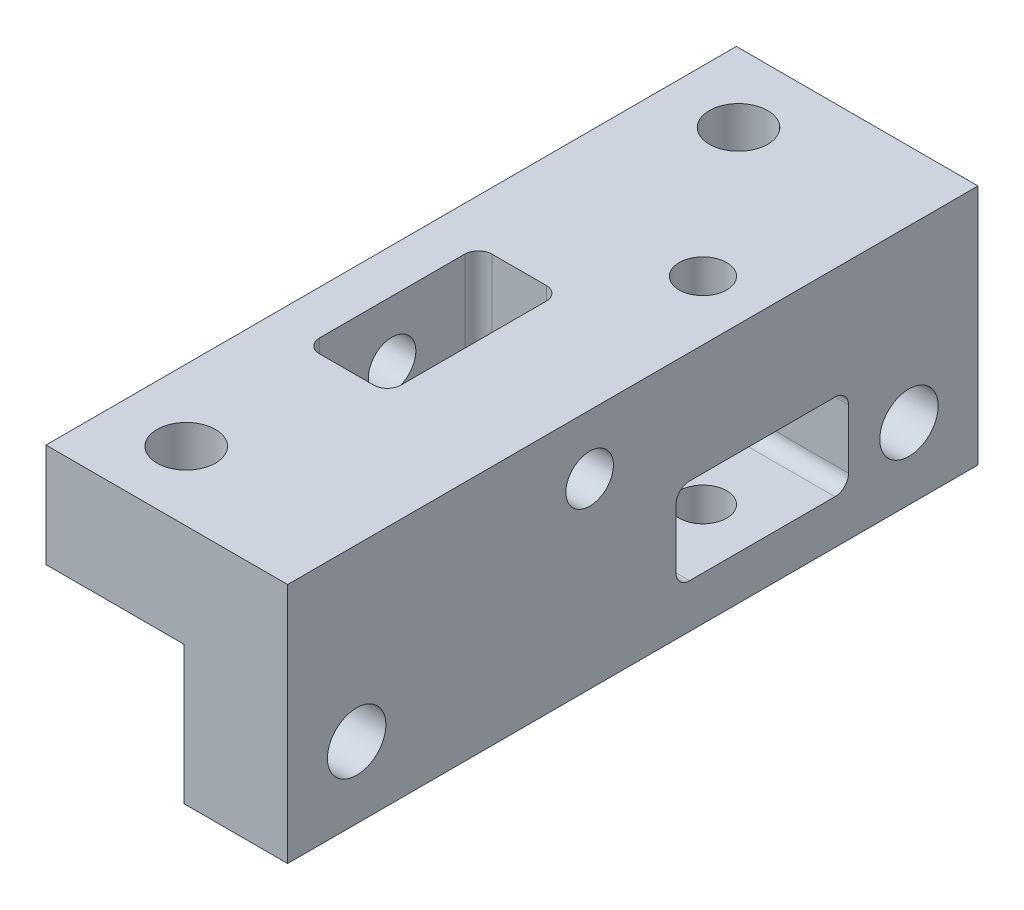
from build123d import *

# Parameters (mm, degrees)
BOSS_EXTRUDE2_DEPTH = 50.8
SKETCH3_R           = 1.75
CUT_EXTRUDE1_DEPTH  = 76.2
SKETCH4_R           = 2.15
SKETCH4_W           = 6.35
SKETCH4_H           = 12.7
CUT_EXTRUDE2_DEPTH  = 76.2
SKETCH6_R           = 1.75
CUT_EXTRUDE3_DEPTH  = 76.2
SKETCH7_R           = 2.15
SKETCH7_W           = 6
SKETCH7_H           = 12.7
CUT_EXTRUDE4_DEPTH  = 76.2
FILLET1_R           = 1


with BuildPart() as part:
    # Sketch2 → Boss-Extrude2 (new body)
    with BuildSketch(Plane(origin=(0, 0, 0), x_dir=(0, 1, 0), z_dir=(0, 0, 1))):
        Polygon((0, 0), (-17.78, 0), (-17.78, 7.62), (-7.62, 7.62), (-7.62, 17.78), (0, 17.78), align=None)
    extrude(amount=BOSS_EXTRUDE2_DEPTH)

    # Sketch3 → Cut-Extrude1 (cut)
    with BuildSketch(Plane(origin=(0, 0, 0), x_dir=(-1, 0, 0), z_dir=(0, 1, 0))):
        with Locations((4.36625, 15.875)):
            Circle(SKETCH3_R)
    extrude(amount=-CUT_EXTRUDE1_DEPTH, mode=Mode.SUBTRACT)

    # Sketch4 → Cut-Extrude2 (cut)
    with BuildSketch(Plane(origin=(-7.62, 0, 0), x_dir=(0, -1, 0), z_dir=(-1, 0, 0))):
        with Locations(Location((12.54125, 5.08, 0), (0, 0, 90))):
            Circle(SKETCH4_R)
        with Locations(Location((12.54125, 45.72, 0), (0, 0, 90))):
            Circle(SKETCH4_R)
        with Locations((11.366242, 15.875)):
            Rectangle(SKETCH4_W, SKETCH4_H)
    extrude(amount=-CUT_EXTRUDE2_DEPTH, mode=Mode.SUBTRACT)

    # Sketch6 → Cut-Extrude3 (cut)
    with BuildSketch(Plane(origin=(-17.78, 0, 0), x_dir=(0, -1, 0), z_dir=(-1, 0, 0))):
        with Locations(Location((4.36626, 28.575, 0), (0, 0, 90))):
            Circle(SKETCH6_R)
    extrude(amount=-CUT_EXTRUDE3_DEPTH, mode=Mode.SUBTRACT)

    # Sketch7 → Cut-Extrude4 (cut)
    with BuildSketch(Plane.XZ.offset(7.62)):
        with Locations((-12.54125, 45.72)):
            Circle(SKETCH7_R)
        with Locations((-12.54125, 5.08)):
            Circle(SKETCH7_R)
        with Locations((-11.541246, 28.575)):
            Rectangle(SKETCH7_W, SKETCH7_H)
    extrude(amount=-CUT_EXTRUDE4_DEPTH, mode=Mode.SUBTRACT)

    # Fillet1
    fillet1_edges = [part.edges().sort_by_distance(p)[0] for p in [
        (-3.81, -8.191242, 22.225),
        (-3.81, -14.541242, 9.525),
        (-3.81, -8.191242, 9.525),
        (-3.81, -14.541242, 22.225),
        (-14.541246, -3.81, 34.925),
        (-8.541246, -3.81, 22.225),
        (-14.541246, -3.81, 22.225),
        (-8.541246, -3.81, 34.925),
    ]]
    fillet(fillet1_edges, radius=FILLET1_R)


solid = part.part
